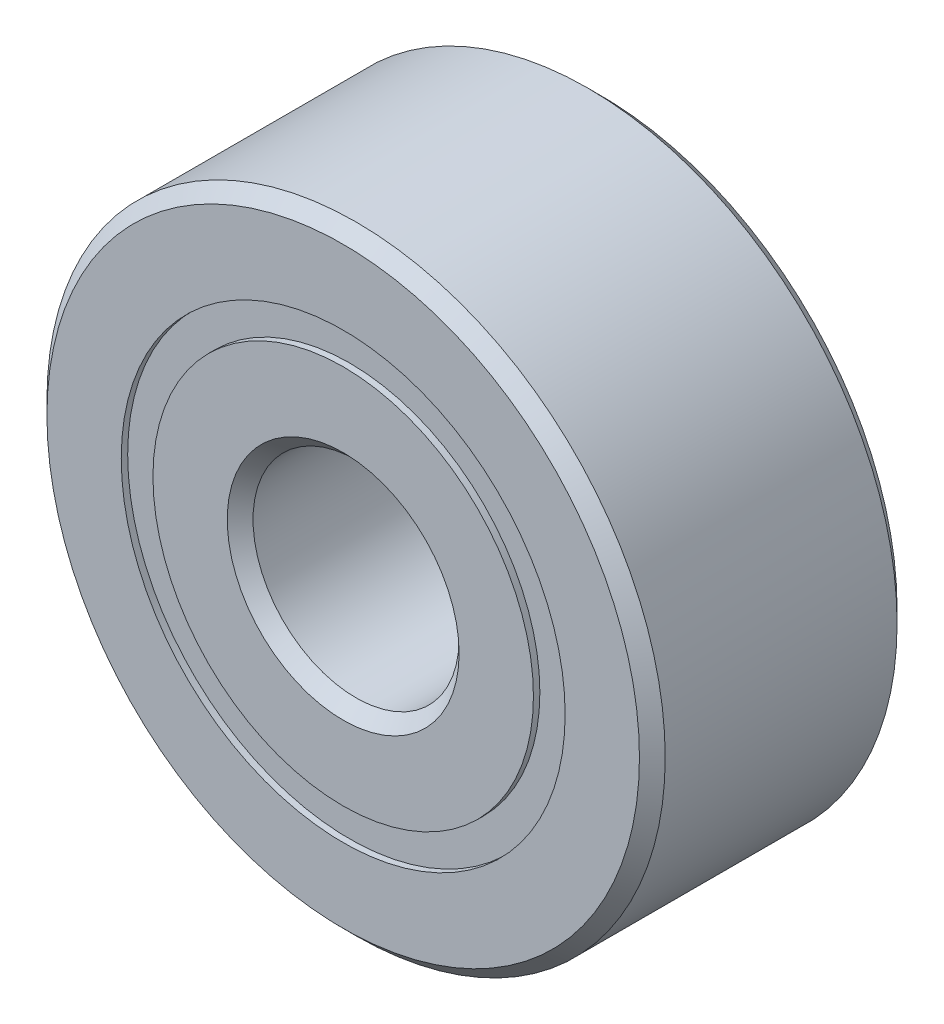
from build123d import *

# Parameters (mm, degrees)
CIRPATTERN1_COUNT = 6
SKETCH5_W         = 0.970019828
SKETCH5_H         = 0.488461538


with BuildPart() as part:
    # Sketch1 → Revolve1 (revolve)
    with BuildSketch(Plane(origin=(0, 0, 0), x_dir=(0, 0, -1), z_dir=(1, 0, 0)), mode=Mode.PRIVATE) as revolve1_sk:
        with BuildLine():
            Line((1.7859375, 4.7625), (-1.7859375, 4.7625))
            Line((-1.7859375, 4.7625), (-1.984375, 4.5640625))
            Line((-1.984375, 4.5640625), (-1.984375, 3.419230769))
            Line((-1.984375, 3.419230769), (-0.881944444, 3.419230769))
            ThreePointArc((-0.881944444, 3.419230769), (0, 4.090136422), (0.881944444, 3.419230769))
            Line((0.881944444, 3.419230769), (1.984375, 3.419230769))
            Line((1.984375, 3.419230769), (1.984375, 4.5640625))
            Line((1.984375, 4.5640625), (1.7859375, 4.7625))
        make_face()
    revolve(revolve1_sk.sketch.rotate(Axis((0, 0, 1.984375), (0, 0, -1)), 90), axis=Axis((0, 0, 1.984375), (0, 0, -1)))


with BuildPart() as body_2:
    # Sketch3 → Revolve3 (revolve)
    with BuildSketch(Plane(origin=(0, 0, 0), x_dir=(0, 0, -1), z_dir=(1, 0, 0)), mode=Mode.PRIVATE) as revolve3_sk:
        with BuildLine():
            Line((-1.984375, 2.930769231), (-0.881944444, 2.930769231))
            ThreePointArc((-0.881944444, 2.930769231), (0, 2.259863578), (0.881944444, 2.930769231))
            Line((0.881944444, 2.930769231), (1.984375, 2.930769231))
            Line((1.984375, 2.930769231), (1.984375, 1.7859375))
            Line((1.984375, 1.7859375), (1.7859375, 1.5875))
            Line((1.7859375, 1.5875), (-1.7859375, 1.5875))
            Line((-1.7859375, 1.5875), (-1.984375, 1.7859375))
            Line((-1.984375, 1.7859375), (-1.984375, 2.930769231))
        make_face()
    revolve(revolve3_sk.sketch.rotate(Axis((0, 0, 1.984375), (0, 0, -1)), 90), axis=Axis((0, 0, 1.984375), (0, 0, -1)))


with BuildPart() as body_3:
    # Sketch4 → Revolve4 (revolve)
    with BuildSketch(Plane(origin=(0, 0, 0), x_dir=(0, 0, -1), z_dir=(1, 0, 0))):
        with BuildLine():
            Line((-0.915136422, 3.175), (0.915136422, 3.175))
            ThreePointArc((0.915136422, 3.175), (0, 4.090136422), (-0.915136422, 3.175))
        make_face()
    revolve(axis=Axis((0, 3.175, 0.915136422), (0, 0, -1)))


with BuildPart() as cirpattern1_1:
    # CirPattern1: pattern copy
    add(body_3.part.rotate(Axis((0, 0, 0), (0, 0, 1)), 1 * 360 / CIRPATTERN1_COUNT))


with BuildPart() as cirpattern1_2:
    # CirPattern1: pattern copy
    add(body_3.part.rotate(Axis((0, 0, 0), (0, 0, 1)), 2 * 360 / CIRPATTERN1_COUNT))


with BuildPart() as cirpattern1_3:
    # CirPattern1: pattern copy
    add(body_3.part.rotate(Axis((0, 0, 0), (0, 0, 1)), 3 * 360 / CIRPATTERN1_COUNT))


with BuildPart() as cirpattern1_4:
    # CirPattern1: pattern copy
    add(body_3.part.rotate(Axis((0, 0, 0), (0, 0, 1)), 4 * 360 / CIRPATTERN1_COUNT))


with BuildPart() as cirpattern1_5:
    # CirPattern1: pattern copy
    add(body_3.part.rotate(Axis((0, 0, 0), (0, 0, 1)), 5 * 360 / CIRPATTERN1_COUNT))


with BuildPart() as body_9:
    # Sketch5 → Revolve5 (revolve)
    with BuildSketch(Plane(origin=(0, 0, 0), x_dir=(0, 0, -1), z_dir=(1, 0, 0)), mode=Mode.PRIVATE) as revolve5_sk:
        with Locations((-1.400146336, 3.175)):
            Rectangle(SKETCH5_W, SKETCH5_H)
        with Locations((1.400146336, 3.175)):
            Rectangle(SKETCH5_W, SKETCH5_H)
    revolve(revolve5_sk.sketch.rotate(Axis((0, 0, 1.984375), (0, 0, -1)), 90), axis=Axis((0, 0, 1.984375), (0, 0, -1)))


solid = Compound([part.part, body_2.part, body_3.part, cirpattern1_1.part, cirpattern1_2.part, cirpattern1_3.part, cirpattern1_4.part, cirpattern1_5.part, body_9.part])
